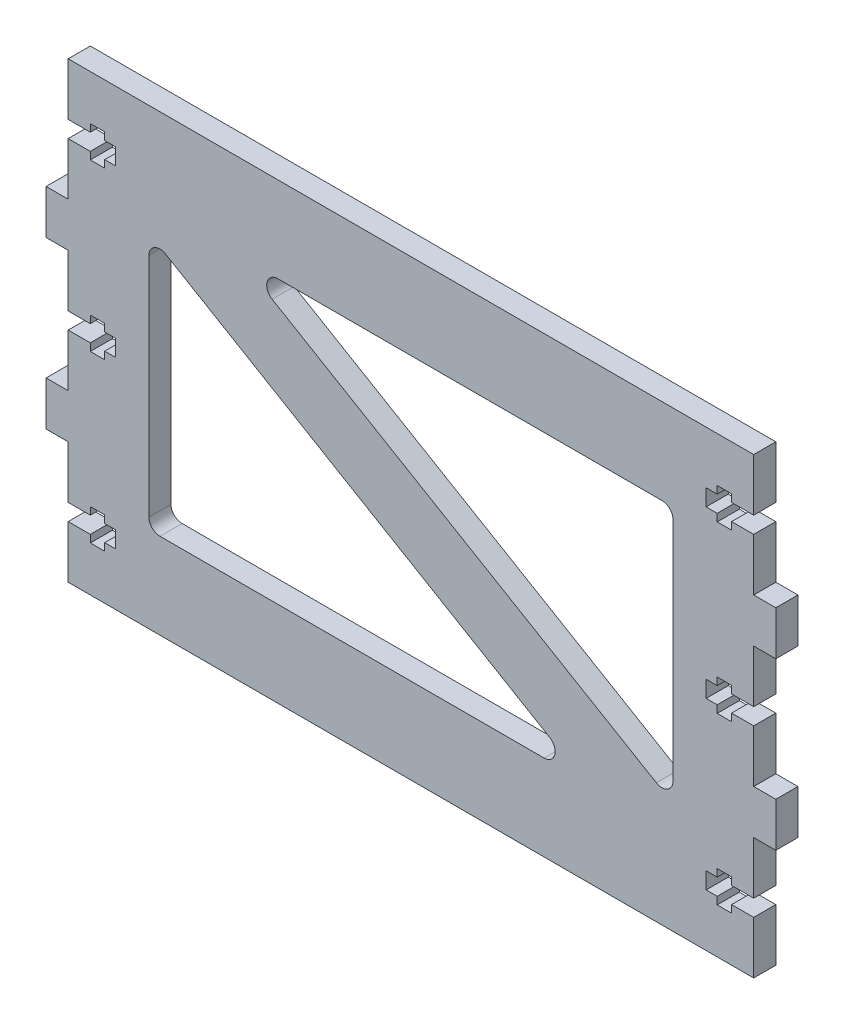
from build123d import *

# Parameters (mm, degrees)
EXTRUDE_1_DEPTH     = 4
CUT_EXTRUDE_1_DEPTH = 10


with BuildPart() as part:
    # 草图1 → 凸台-拉伸1 (new body)
    with BuildSketch(Plane.XY):
        Polygon((54.534285714, 6.73), (50.534285714, 6.73), (50.534285714, 8.08), (47.934285714, 8.08), (47.934285714, 6.73), (45.934285714, 6.73), (45.934285714, 3.73), (47.934285714, 3.73), (47.934285714, 2.38), (50.534285714, 2.38), (50.534285714, 3.73), (54.534285714, 3.73), (54.534285714, -5.77), (58.534285714, -5.77), (58.534285714, -13.77), (54.534285714, -13.77), (54.534285714, -23.27), (50.534285714, -23.27), (50.534285714, -21.92), (47.934285714, -21.92), (47.934285714, -23.27), (45.934285714, -23.27), (45.934285714, -26.27), (47.934285714, -26.27), (47.934285714, -27.62), (50.534285714, -27.62), (50.534285714, -26.27), (54.534285714, -26.27), (54.534285714, -35.77), (-69.465714286, -35.77), (-69.465714286, -26.27), (-65.465714286, -26.27), (-65.465714286, -27.62), (-62.865714286, -27.62), (-62.865714286, -26.27), (-60.865714286, -26.27), (-60.865714286, -23.27), (-62.865714286, -23.27), (-62.865714286, -21.92), (-65.465714286, -21.92), (-65.465714286, -23.27), (-69.465714286, -23.27), (-69.465714286, -13.77), (-73.465714286, -13.77), (-73.465714286, -5.77), (-69.465714286, -5.77), (-69.465714286, 3.73), (-65.465714286, 3.73), (-65.465714286, 2.38), (-62.865714286, 2.38), (-62.865714286, 3.73), (-60.865714286, 3.73), (-60.865714286, 6.73), (-62.865714286, 6.73), (-62.865714286, 8.08), (-65.465714286, 8.08), (-65.465714286, 6.73), (-69.465714286, 6.73), (-69.465714286, 16.23), (-73.465714286, 16.23), (-73.465714286, 24.23), (-69.465714286, 24.23), (-69.465714286, 33.73), (-65.465714286, 33.73), (-65.465714286, 32.38), (-62.865714286, 32.38), (-62.865714286, 33.73), (-60.865714286, 33.73), (-60.865714286, 36.73), (-62.865714286, 36.73), (-62.865714286, 38.08), (-65.465714286, 38.08), (-65.465714286, 36.73), (-69.465714286, 36.73), (-69.465714286, 46.23), (54.534285714, 46.23), (54.534285714, 36.73), (50.534285714, 36.73), (50.534285714, 38.08), (47.934285714, 38.08), (47.934285714, 36.73), (45.934285714, 36.73), (45.934285714, 33.73), (47.934285714, 33.73), (47.934285714, 32.38), (50.534285714, 32.38), (50.534285714, 33.73), (54.534285714, 33.73), (54.534285714, 24.23), (58.534285714, 24.23), (58.534285714, 16.23), (54.534285714, 16.23), align=None)
    extrude(amount=EXTRUDE_1_DEPTH)

    # 草图3 → 切除-拉伸1 (cut)
    with BuildSketch(Plane.XY.offset(4)):
        with BuildLine():
            Line((17.642892502, -16.547376782), (-51.84956014, 24.445362136))
            ThreePointArc((-51.84956014, 24.445362136), (-53.857604327, 24.459446765), (-54.865714286, 22.722738918))
            Line((-54.865714286, 22.722738918), (-54.865714286, -18.27))
            ThreePointArc((-54.865714286, -18.27), (-54.279927848, -19.684213562), (-52.865714286, -20.27))
            Line((-52.865714286, -20.27), (16.626738356, -20.27))
            ThreePointArc((16.626738356, -20.27), (18.556148426, -18.796665721), (17.642892502, -16.547376782))
        make_face()
        with BuildLine():
            Line((-31.558166927, 30.73), (37.934285714, 30.73))
            ThreePointArc((37.934285714, 30.73), (39.348499277, 30.144213562), (39.934285714, 28.73))
            Line((39.934285714, 28.73), (39.934285714, -12.262738918))
            ThreePointArc((39.934285714, -12.262738918), (38.926175756, -13.999446765), (36.918131569, -13.985362136))
            Line((36.918131569, -13.985362136), (-32.574321073, 27.007376782))
            ThreePointArc((-32.574321073, 27.007376782), (-33.487576998, 29.256665721), (-31.558166927, 30.73))
        make_face()
    extrude(amount=-CUT_EXTRUDE_1_DEPTH, mode=Mode.SUBTRACT)


solid = part.part
